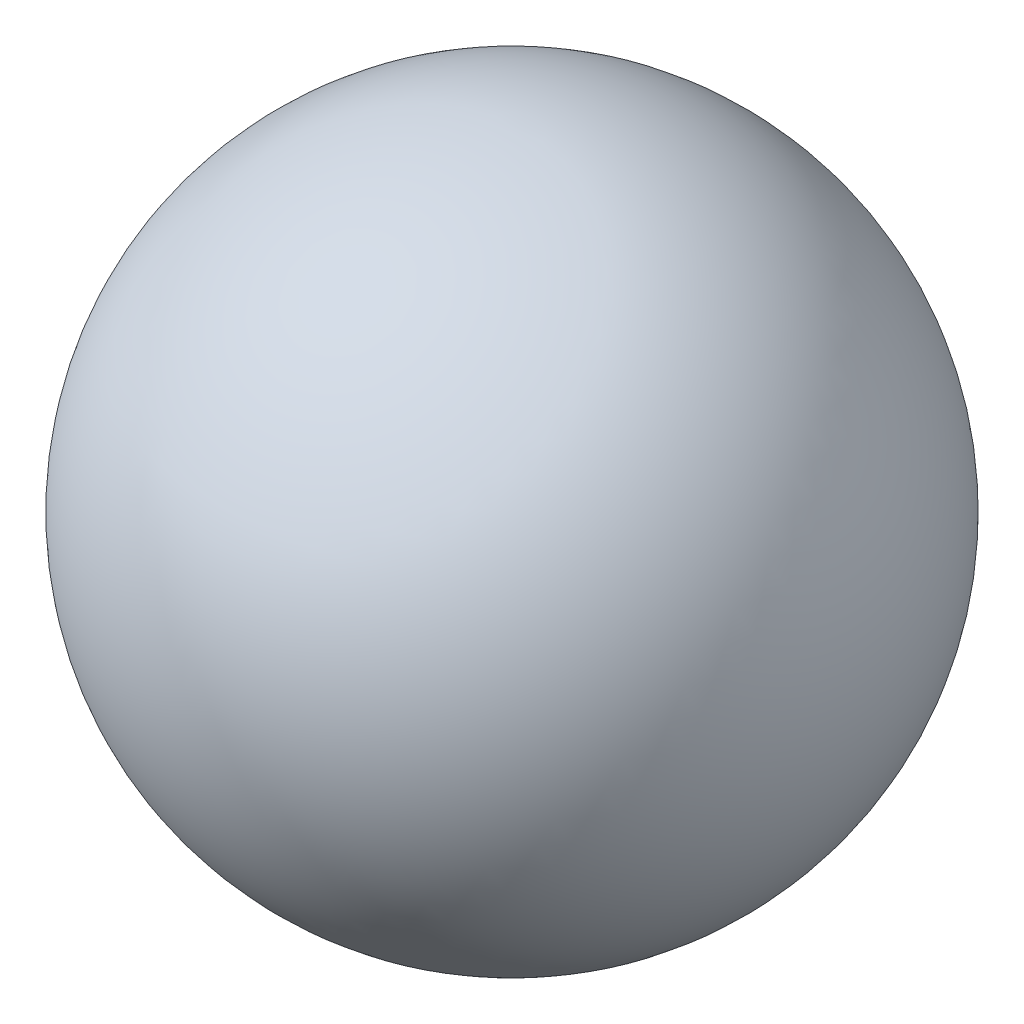
from build123d import *


with BuildPart() as part:
    # Croquis2 → Revolución1 (revolve)
    with BuildSketch(Plane(origin=(0, 0, 0), x_dir=(0, 0, -1), z_dir=(1, 0, 0))):
        with BuildLine():
            Line((0, 0), (0, 74))
            ThreePointArc((0, 74), (-37, 37), (0, 0))
        make_face()
    revolve(axis=Axis((0, 74, 0), (0, -1, 0)))


solid = part.part
